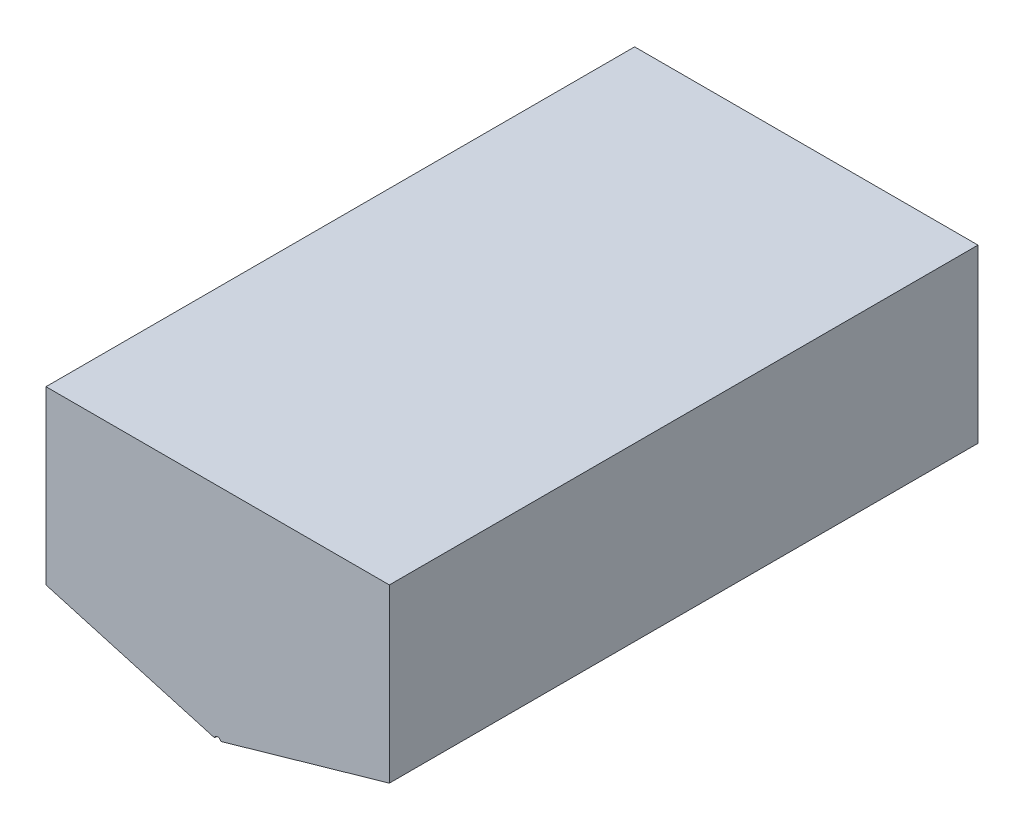
from build123d import *

# Parameters (mm, degrees)
RESSALTO_EXTRUS_O1_DEPTH = 120
ESBO_O3_R                = 0.675
CORTE_EXTRUS_O1_DEPTH    = 30


with BuildPart() as part:
    # Esboço1 → Ressalto-extrusão1 (new body)
    with BuildSketch(Plane.XY):
        with BuildLine():
            Line((35, -12.5), (35, 22.5))
            Line((35, 22.5), (-35, 22.5))
            Line((-35, 22.5), (-35, -12.5))
            Line((-35, -12.5), (-0.384609579, -22.390111549))
            ThreePointArc((-0.384609579, -22.390111549), (0.017433528, -22.081919349), (0.42886001, -22.377468569))
            Line((0.42886001, -22.377468569), (35, -12.5))
        make_face()
    extrude(amount=RESSALTO_EXTRUS_O1_DEPTH)

    # Esboço3 → Corte-extrusão1 (cut)
    with BuildSketch(Plane.XY.offset(120)):
        with Locations((0, -22.5)):
            Circle(ESBO_O3_R)
    extrude(amount=-CORTE_EXTRUS_O1_DEPTH, mode=Mode.SUBTRACT)


solid = part.part
